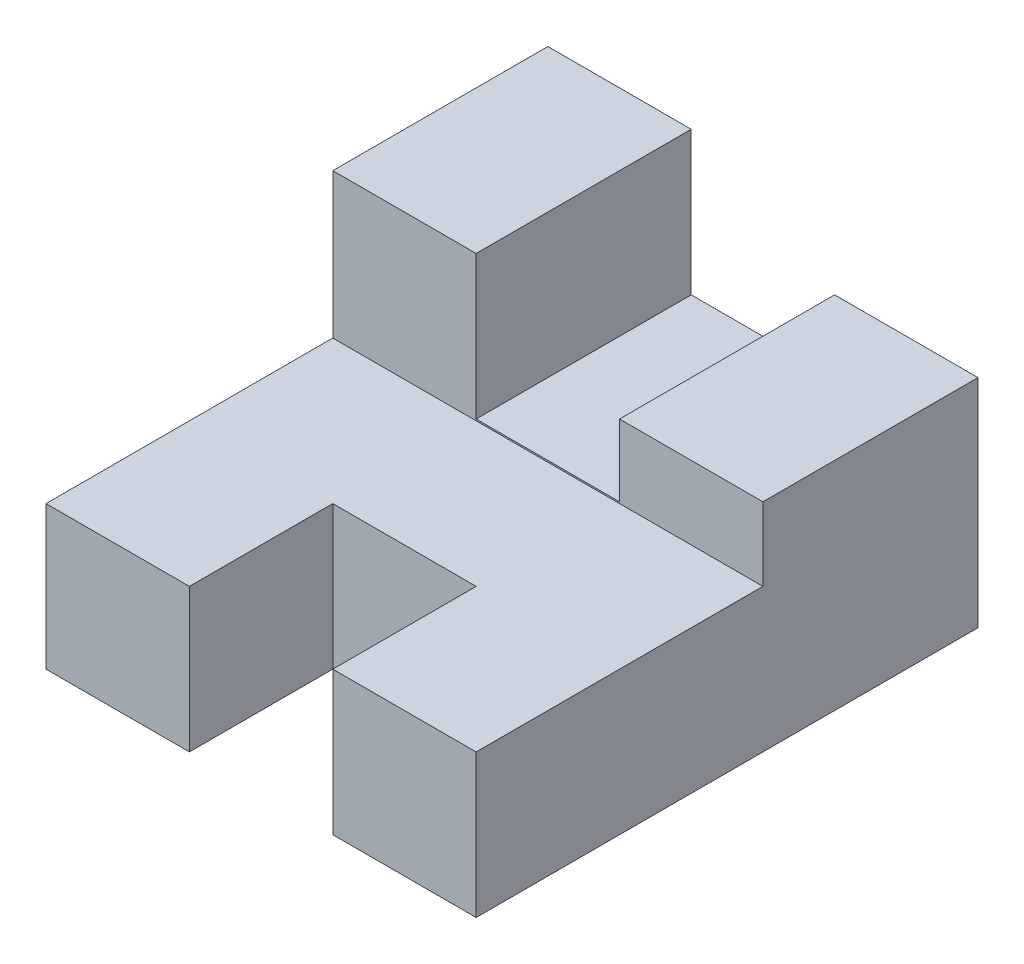
from build123d import *

# Parameters (mm, degrees)
ESBO_O1_W                = 60
ESBO_O1_H                = 20
RESSALTO_EXTRUS_O1_DEPTH = 40
ESBO_O2_W                = 20
ESBO_O2_H                = 20
CORTE_EXTRUS_O1_DEPTH    = 40
ESBO_O3_W                = 60
ESBO_O3_H                = 40.21646748
RESSALTO_EXTRUS_O2_DEPTH = 30
ESBO_O4_W                = 20
ESBO_O4_H                = 30
CORTE_EXTRUS_O4_DEPTH    = 20
ESBO_O7_W                = 20
ESBO_O7_H                = 30
CORTE_EXTRUS_O6_DEPTH    = 10


with BuildPart() as part:
    # Esboço1 → Ressalto-extrusão1 (new body)
    with BuildSketch(Plane.XY):
        with Locations((30, 10)):
            Rectangle(ESBO_O1_W, ESBO_O1_H)
    extrude(amount=RESSALTO_EXTRUS_O1_DEPTH)

    # Esboço2 → Corte-extrusão1 (cut)
    with BuildSketch(Plane(origin=(0, 20, 0), x_dir=(1, 0, 0), z_dir=(0, 1, 0))):
        with Locations((30, -30)):
            Rectangle(ESBO_O2_W, ESBO_O2_H)
    extrude(amount=-CORTE_EXTRUS_O1_DEPTH, mode=Mode.SUBTRACT)

    # Esboço3 → Ressalto-extrusão2 (add)
    with BuildSketch(Plane(origin=(0, 0, 0), x_dir=(-1, 0, 0), z_dir=(0, 0, -1))):
        with Locations((-30, 20.10823374)):
            Rectangle(ESBO_O3_W, ESBO_O3_H)
    extrude(amount=RESSALTO_EXTRUS_O2_DEPTH)

    # Esboço4 → Corte-extrusão4 (cut)
    with BuildSketch(Plane(origin=(0, 40.21646748, 0), x_dir=(1, 0, 0), z_dir=(0, 1, 0))):
        with Locations((30, 15)):
            Rectangle(ESBO_O4_W, ESBO_O4_H)
    extrude(amount=-CORTE_EXTRUS_O4_DEPTH, mode=Mode.SUBTRACT)

    # Esboço7 → Corte-extrusão6 (cut)
    with BuildSketch(Plane(origin=(0, 40.21646748, 0), x_dir=(1, 0, 0), z_dir=(0, 1, 0))):
        with Locations((50, 15)):
            Rectangle(ESBO_O7_W, ESBO_O7_H)
    extrude(amount=-CORTE_EXTRUS_O6_DEPTH, mode=Mode.SUBTRACT)


solid = part.part
